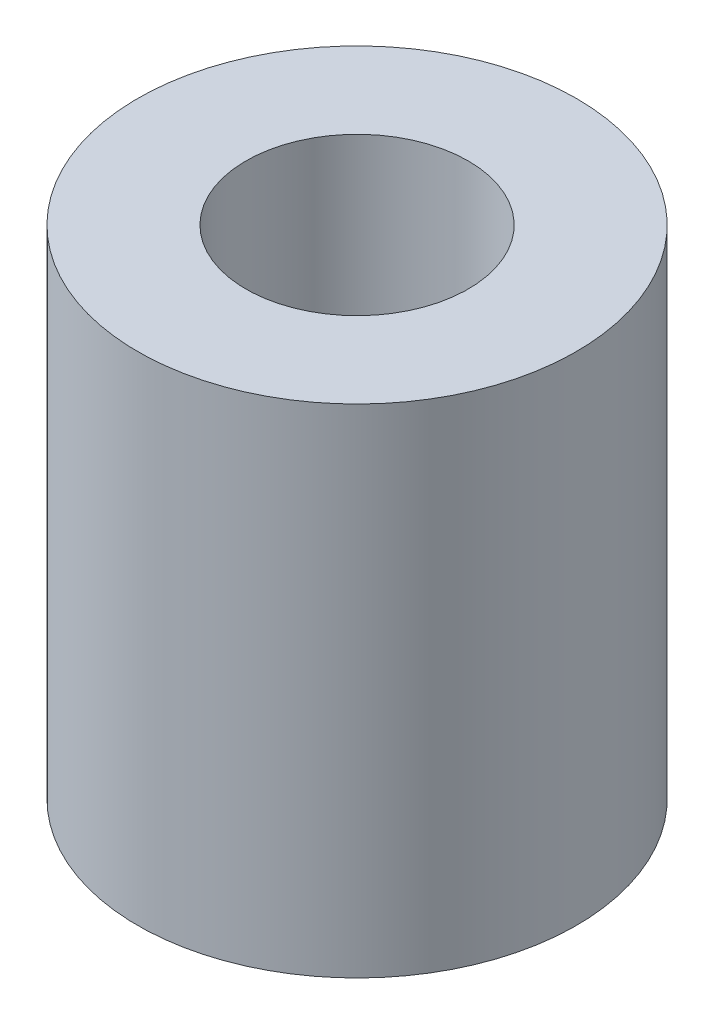
from build123d import *

# Parameters (mm, degrees)
SKETCH1_R           = 9.525
SKETCH1_R_2         = 4.826
BOSS_EXTRUDE1_DEPTH = 21.59


with BuildPart() as part:
    # Sketch1 → Boss-Extrude1 (new body)
    with BuildSketch(Plane(origin=(0, 21.59, 0), x_dir=(1, 0, 0), z_dir=(0, 1, 0))):
        with Locations(Location((0, 0, 0), (0, 0, 90))):
            Circle(SKETCH1_R)
        with Locations(Location((0, 0, 0), (0, 0, 90))):
            Circle(SKETCH1_R_2, mode=Mode.SUBTRACT)
    extrude(amount=-BOSS_EXTRUDE1_DEPTH)


solid = part.part
